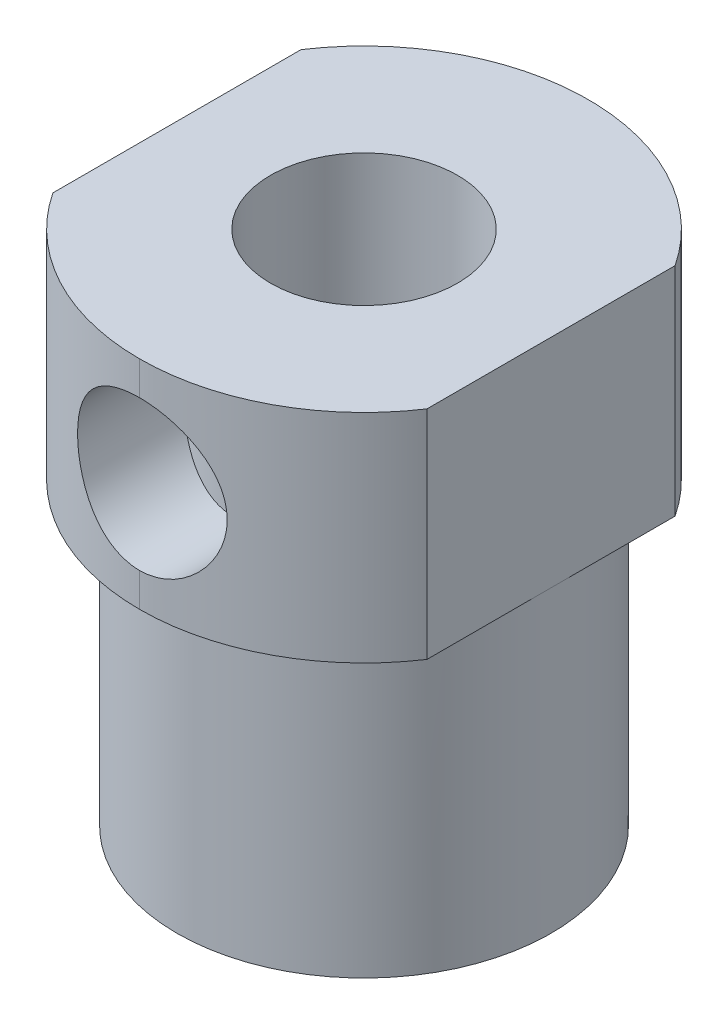
from build123d import *

# Parameters (mm, degrees)
CUT_EXTRUDE1_REACH      = 21.247
CUT_EXTRUDE1_END_RADIUS = 3.5
SKETCH5_R               = 2
SKETCH7_W               = 1
SKETCH7_H               = 12
CUT_EXTRUDE2_DEPTH      = 5.8


with BuildPart() as part:
    # Sweep1: sweep along a path in Sketch2
    with BuildLine(Plane(origin=(0, 0, 0), x_dir=(1, 0, 0), z_dir=(0, 1, 0))) as sweep1_path:
        CenterArc((0, 0), 5, 0, 360)
    # Sketch4 → Sweep1 (sweep)
    with BuildSketch(Plane(origin=(0, 0, 0), x_dir=(0, 0, -1), z_dir=(1, 0, 0))):
        Polygon((-2.4, 0), (-2.4, 3), (-0.75, 3), (-0.75, 5), (-2.5, 5), (-2.5, 13.8), (-6, 13.8), (-6, 8), (-5, 8), (-5, 0), align=None)
    sweep(path=sweep1_path.line)

    # Cut-Extrude1: up to this cylinder (the profile starts outside it)
    cut_extrude1_end = Plane(origin=(0, 10.9, 0), z_dir=(0, 1, 0)) * Cylinder(CUT_EXTRUDE1_END_RADIUS, 50.494, mode=Mode.PRIVATE)
    # Sketch5 → Cut-Extrude1 (cut, up to the surface)
    with BuildSketch(Plane(origin=(0, 13.8, 6), x_dir=(1, 0, 0), z_dir=(0, 0, 1)), mode=Mode.PRIVATE) as cut_extrude1_sk1:
        with Locations((0, -2.9)):
            Circle(SKETCH5_R)
    cut_extrude1_tool1 = extrude(cut_extrude1_sk1.sketch, amount=-CUT_EXTRUDE1_REACH, mode=Mode.PRIVATE) - cut_extrude1_end
    add(cut_extrude1_tool1.solids().sort_by_distance((0, 10.9, 6))[0], mode=Mode.SUBTRACT)

    # Sketch7 → Cut-Extrude2 (cut)
    with BuildSketch(Plane(origin=(0, 13.8, 0), x_dir=(1, 0, 0), z_dir=(0, 1, 0))):
        with Locations((-5.5, 0)):
            Rectangle(SKETCH7_W, SKETCH7_H)
        with Locations((5.5, 0)):
            Rectangle(SKETCH7_W, SKETCH7_H)
    extrude(amount=-CUT_EXTRUDE2_DEPTH, mode=Mode.SUBTRACT)


solid = part.part
